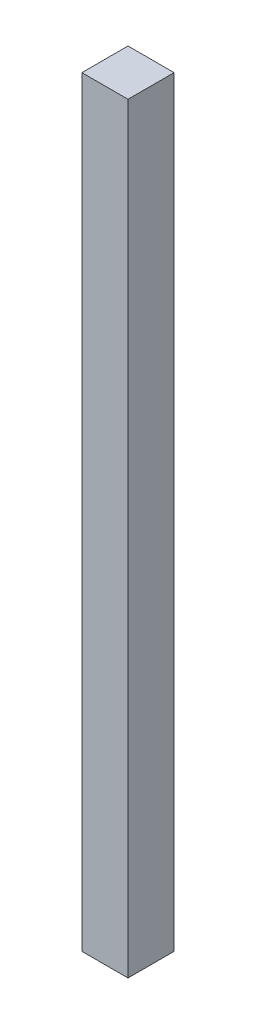
from build123d import *

# Parameters (mm, degrees)
SKETCH1_W           = 20
SKETCH1_H           = 20
BOSS_EXTRUDE1_DEPTH = 330


with BuildPart() as part:
    # Sketch1 → Boss-Extrude1 (new body)
    with BuildSketch(Plane(origin=(0, 0, 0), x_dir=(1, 0, 0), z_dir=(0, 1, 0))):
        Rectangle(SKETCH1_W, SKETCH1_H)
    extrude(amount=BOSS_EXTRUDE1_DEPTH)


solid = part.part
